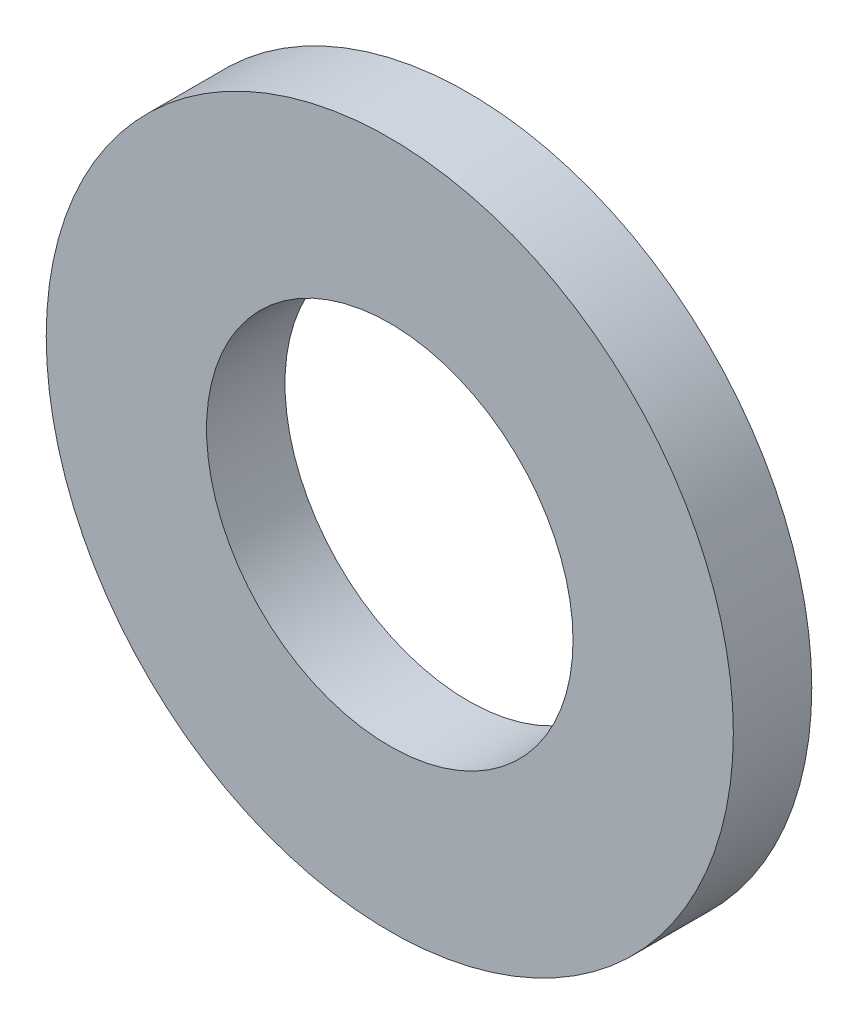
from build123d import *

# Parameters (mm, degrees)
SKETCH1_R      = 6
SKETCH1_R_2    = 3.2
EXTRUDE1_DEPTH = 1.37


with BuildPart() as part:
    # Sketch1 → Extrude1 (new body)
    with BuildSketch(Plane.XY):
        Circle(SKETCH1_R)
        Circle(SKETCH1_R_2, mode=Mode.SUBTRACT)
    extrude(amount=-EXTRUDE1_DEPTH)


solid = part.part
